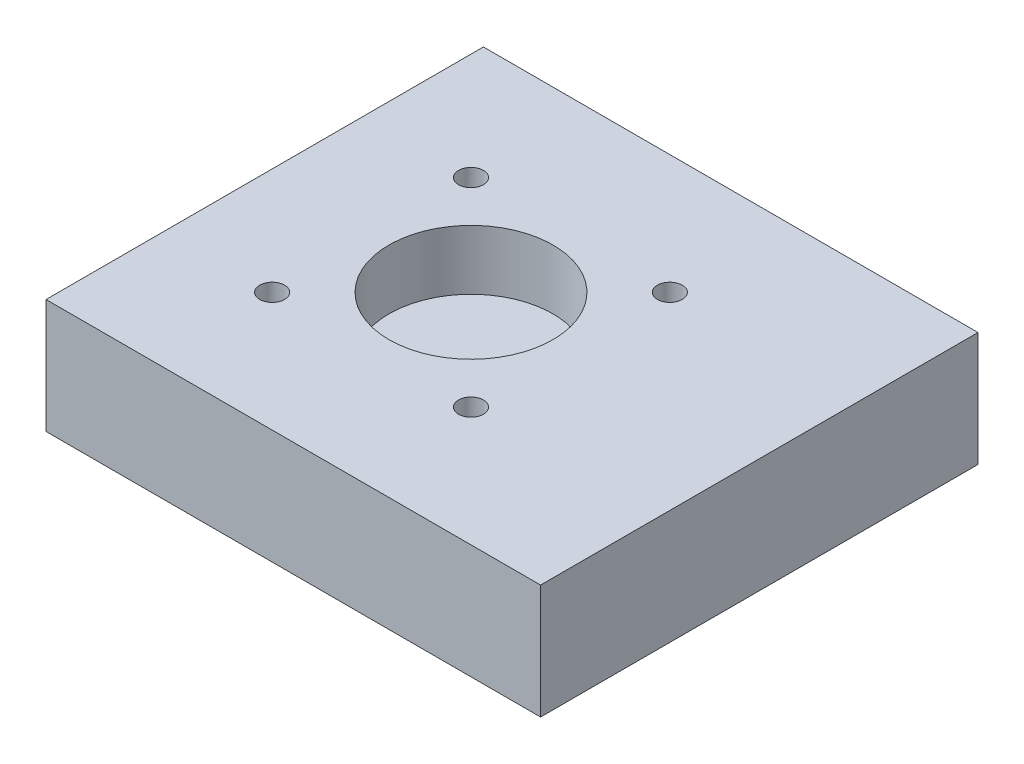
from build123d import *

# Parameters (mm, degrees)
SKETCH1_W                        = 58
SKETCH1_H                        = 44
BOSS_EXTRUDE1_DEPTH              = 11.5
F_16_5_16_5_DIAMETER_HOLE1_D     = 16.5
F_16_5_16_5_DIAMETER_HOLE1_DEPTH = 6
M3X0_5_TAPPED_HOLE1_D            = 2.5
M3X0_5_TAPPED_HOLE1_DEPTH        = 7.5
CUT_EXTRUDE1_DEPTH               = 10.3
CUT_EXTRUDE2_DEPTH               = 10.3
SKETCH13_W                       = 8.25
SKETCH13_H                       = 44
CUT_EXTRUDE3_DEPTH               = 39.173943993
M2_5X0_45_TAPPED_HOLE1_D         = 2.05
M2_5X0_45_TAPPED_HOLE1_DEPTH     = 6.35
SKETCH16_W                       = 13
SKETCH16_H                       = 4
CUT_EXTRUDE4_DEPTH               = 1.2


with BuildPart() as part:
    # Sketch1 → Boss-Extrude1 (new body)
    with BuildSketch(Plane(origin=(0, 0, 0), x_dir=(1, 0, 0), z_dir=(0, 1, 0))):
        Rectangle(SKETCH1_W, SKETCH1_H)
    extrude(amount=BOSS_EXTRUDE1_DEPTH)

    # Ø16.5 (16.5) Diameter Hole1
    with Locations(Plane(origin=(0, 11.5, 0), x_dir=(1, 0, 0), z_dir=(0, 1, 0))):
        with Locations((0, 0)):
            Hole(F_16_5_16_5_DIAMETER_HOLE1_D / 2, depth=F_16_5_16_5_DIAMETER_HOLE1_DEPTH)

    # M3x0.5 Tapped Hole1
    with Locations(Plane(origin=(0, 11.5, 0), x_dir=(1, 0, 0), z_dir=(0, 1, 0))):
        with Locations((-10, 10), (10, 10), (-10, -10), (10, -10)):
            Hole(M3X0_5_TAPPED_HOLE1_D / 2, depth=M3X0_5_TAPPED_HOLE1_DEPTH)

    # Sketch10 → Cut-Extrude1 (cut)
    with BuildSketch(Plane.XZ):
        with BuildLine():
            Line((3, 20.5), (-3, 20.5))
            ThreePointArc((-3, 20.5), (-5.121320344, 19.621320344), (-6, 17.5))
            Line((-6, 17.5), (-6, 15.5))
            ThreePointArc((-6, 15.5), (-5.121320344, 13.378679656), (-3, 12.5))
            Line((-3, 12.5), (3, 12.5))
            ThreePointArc((3, 12.5), (5.121320344, 13.378679656), (6, 15.5))
            Line((6, 15.5), (6, 17.5))
            ThreePointArc((6, 17.5), (5.121320344, 19.621320344), (3, 20.5))
        make_face()
        with BuildLine():
            Line((-6, -15.5), (-6, -17.499999942))
            ThreePointArc((-6, -17.499999942), (-5.121320364, -19.621320323), (-3, -20.5))
            Line((-3, -20.5), (3, -20.5))
            ThreePointArc((3, -20.5), (5.121320344, -19.621320344), (6, -17.5))
            Line((6, -17.5), (6, -15.5))
            ThreePointArc((6, -15.5), (5.121320344, -13.378679656), (3, -12.5))
            Line((3, -12.5), (-3, -12.5))
            ThreePointArc((-3, -12.5), (-5.121320344, -13.378679656), (-6, -15.5))
        make_face()
    extrude(amount=-CUT_EXTRUDE1_DEPTH, mode=Mode.SUBTRACT)

    # Sketch11 → Cut-Extrude2 (cut)
    with BuildSketch(Plane.XZ):
        with BuildLine():
            ThreePointArc((-12.5, 15.5), (-13.232233047, 17.267766953), (-15, 18))
            Line((-15, 18), (-16, 18))
            ThreePointArc((-16, 18), (-17.767766953, 17.267766953), (-18.5, 15.5))
            Line((-18.5, 15.5), (-18.5, 6.5))
            ThreePointArc((-18.5, 6.5), (-17.767766953, 4.732233047), (-16, 4))
            Line((-16, 4), (-15, 4))
            ThreePointArc((-15, 4), (-13.232233047, 4.732233047), (-12.5, 6.5))
            Line((-12.5, 6.5), (-12.5, 15.5))
        make_face()
        with BuildLine():
            ThreePointArc((-12.5, -6.5), (-13.232233047, -4.732233047), (-15, -4))
            Line((-15, -4), (-16, -4))
            ThreePointArc((-16, -4), (-17.767766953, -4.732233047), (-18.5, -6.5))
            Line((-18.5, -6.5), (-18.5, -15.5))
            ThreePointArc((-18.5, -15.5), (-17.767766953, -17.267766953), (-16, -18))
            Line((-16, -18), (-15, -18))
            ThreePointArc((-15, -18), (-13.232233047, -17.267766953), (-12.5, -15.5))
            Line((-12.5, -15.5), (-12.5, -6.5))
        make_face()
    extrude(amount=-CUT_EXTRUDE2_DEPTH, mode=Mode.SUBTRACT)

    # Sketch13 → Cut-Extrude3 (cut, through all)
    with BuildSketch(Plane.XZ):
        with Locations((-24.875, 0)):
            Rectangle(SKETCH13_W, SKETCH13_H)
    extrude(amount=-CUT_EXTRUDE3_DEPTH, mode=Mode.SUBTRACT)

    # M2.5x0.45 Tapped Hole1
    with Locations(Plane(origin=(0, 0, 0), x_dir=(-1, 0, 0), z_dir=(0, -1, 0))):
        with Locations((-17.5, 6), (-17.5, -6), (-17.5, -18), (-17.5, 18)):
            Hole(M2_5X0_45_TAPPED_HOLE1_D / 2, depth=M2_5X0_45_TAPPED_HOLE1_DEPTH)

    # Sketch16 → Cut-Extrude4 (cut)
    with BuildSketch(Plane.XZ):
        with Locations((0, 16.5)):
            Rectangle(SKETCH16_W, SKETCH16_H)
    extrude(amount=-CUT_EXTRUDE4_DEPTH, mode=Mode.SUBTRACT)


solid = part.part
